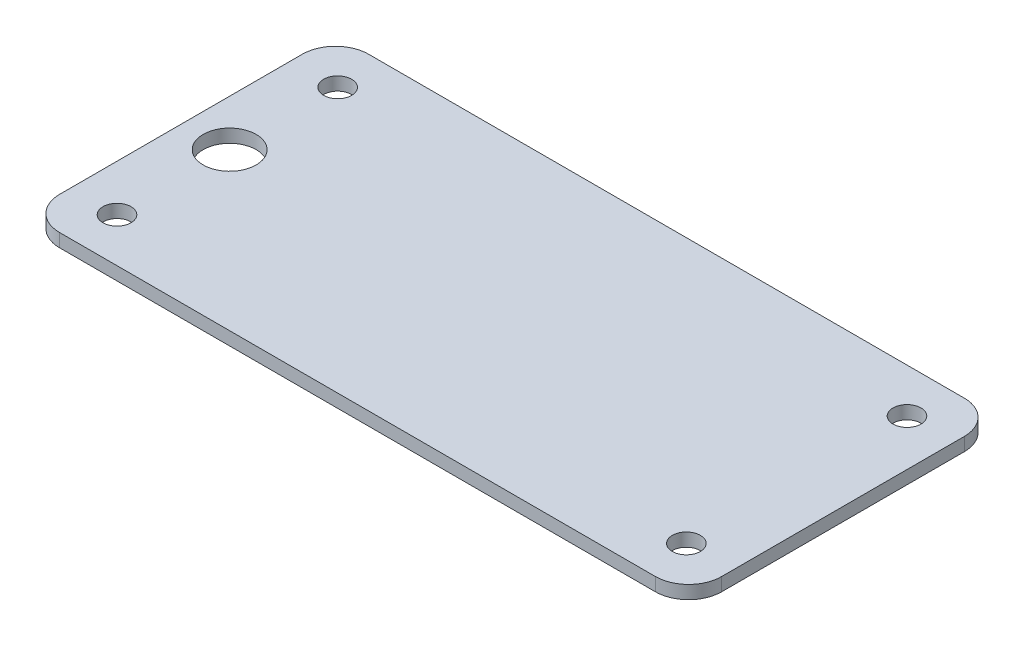
from build123d import *

# Parameters (mm, degrees)
ESBO_O2_W                = 150
ESBO_O2_H                = 70
RESSALTO_EXTRUS_O1_DEPTH = 3
ESBO_O4_R                = 3.175
CORTE_EXTRUS_O1_DEPTH    = 3
FILETE1_R                = 7.5
ESBO_O6_R                = 6
CORTE_EXTRUS_O2_DEPTH    = 10


with BuildPart() as part:
    # Esboço2 → Ressalto-extrusão1 (new body)
    with BuildSketch(Plane(origin=(0, 0, 0), x_dir=(1, 0, 0), z_dir=(0, 1, 0))):
        with Locations((75, 35)):
            Rectangle(ESBO_O2_W, ESBO_O2_H)
    extrude(amount=RESSALTO_EXTRUS_O1_DEPTH)

    # Esboço4 → Corte-extrusão1 (cut)
    with BuildSketch(Plane(origin=(0, 3, 0), x_dir=(1, 0, 0), z_dir=(0, 1, 0))):
        with Locations(Location((10.5, 60, 0), (0, 0, 270))):
            Circle(ESBO_O4_R)
        with Locations(Location((139.5, 60, 0), (0, 0, 270))):
            Circle(ESBO_O4_R)
        with Locations(Location((139.5, 10, 0), (0, 0, 270))):
            Circle(ESBO_O4_R)
        with Locations(Location((10.5, 10, 0), (0, 0, 270))):
            Circle(ESBO_O4_R)
    extrude(amount=-CORTE_EXTRUS_O1_DEPTH, mode=Mode.SUBTRACT)

    # Filete1
    filete1_edges = [part.edges().sort_by_distance(p)[0] for p in [
        (0, 1.5, -70),
        (150, 1.5, -70),
        (150, 1.5, 0),
        (0, 1.5, 0),
    ]]
    fillet(filete1_edges, radius=FILETE1_R)

    # Esboço6 → Corte-extrusão2 (cut)
    with BuildSketch(Plane(origin=(0, 3, 0), x_dir=(1, 0, 0), z_dir=(0, 1, 0))):
        with Locations(Location((10.5, 35.526964124, 0), (0, 0, 270))):
            Circle(ESBO_O6_R)
    extrude(amount=-CORTE_EXTRUS_O2_DEPTH, mode=Mode.SUBTRACT)


solid = part.part
